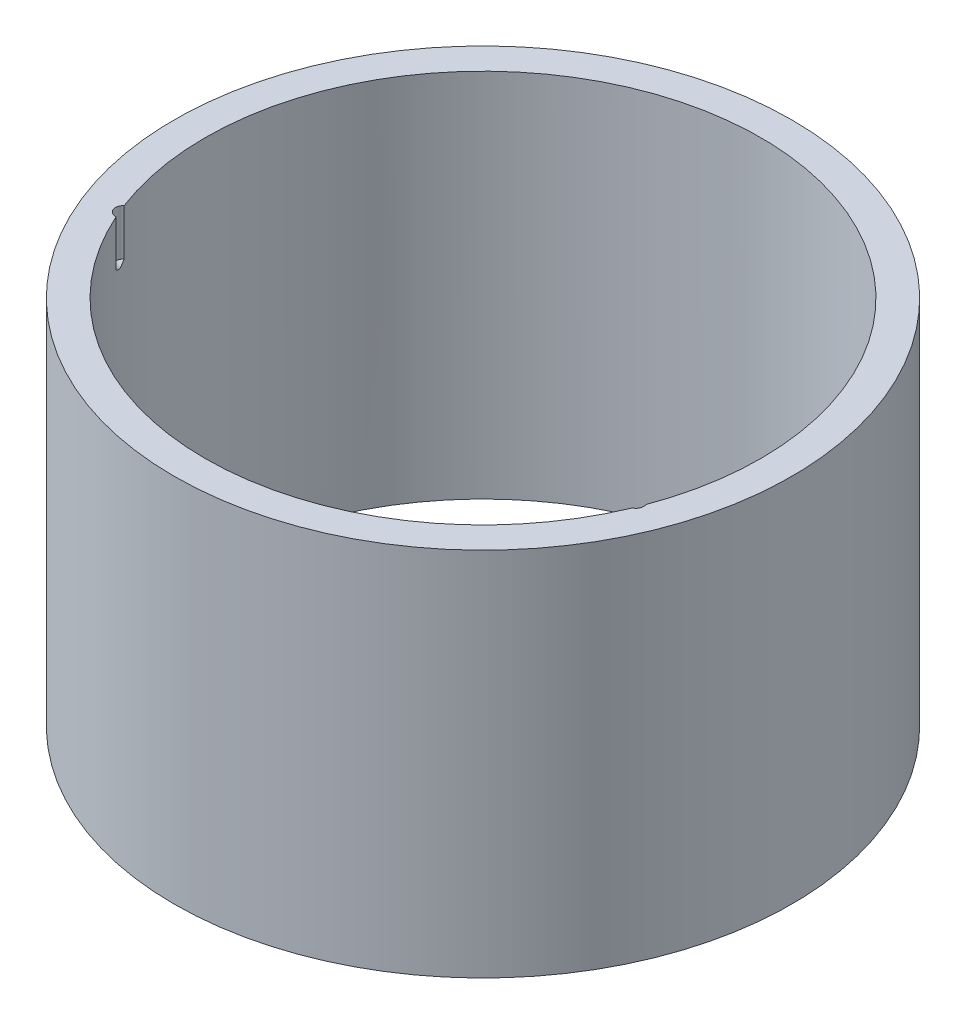
from build123d import *

# Parameters (mm, degrees)
SKETCH1_R             = 50
BOSS_EXTRUDE1_DEPTH   = 60
SKETCH2_R             = 45
CUT_EXTRUDE1_DEPTH    = 93.736184955
M3_TAPPED_HOLE2_D     = 2.5
M3_TAPPED_HOLE2_DEPTH = 7.5
M3_TAPPED_HOLE2_TIP   = 0.751075774


with BuildPart() as part:
    # Sketch1 → Boss-Extrude1 (new body)
    with BuildSketch(Plane(origin=(0, 0, 0), x_dir=(1, 0, 0), z_dir=(0, 1, 0))):
        with Locations(Location((0, 0, 0), (0, 0, 270))):
            Circle(SKETCH1_R)
    extrude(amount=BOSS_EXTRUDE1_DEPTH)

    # Sketch2 → Cut-Extrude1 (cut, through all)
    with BuildSketch(Plane(origin=(0, 60, 0), x_dir=(1, 0, 0), z_dir=(0, 1, 0))):
        with Locations(Location((0, 0, 0), (0, 0, 270))):
            Circle(SKETCH2_R)
    extrude(amount=-CUT_EXTRUDE1_DEPTH, mode=Mode.SUBTRACT)

    # M3 Tapped Hole2
    with Locations(Plane(origin=(-125, 60, -260), x_dir=(-1, 0, 0), z_dir=(0, 1, 0))):
        with Locations((-125.588729382, 346.343542242), (-83.789316087, 277.051897383), (-165.985477802, 276.210298458), (165.689643288, 275.872555658), (83.529497195, 276.252926704), (125.273893117, 347.014910337)):
            Hole(M3_TAPPED_HOLE2_D / 2, depth=M3_TAPPED_HOLE2_DEPTH)
            with Locations((0, 0, -(M3_TAPPED_HOLE2_DEPTH + M3_TAPPED_HOLE2_TIP / 2))):  # 118° drill point
                Cone(0, M3_TAPPED_HOLE2_D / 2, M3_TAPPED_HOLE2_TIP, mode=Mode.SUBTRACT)


solid = part.part
